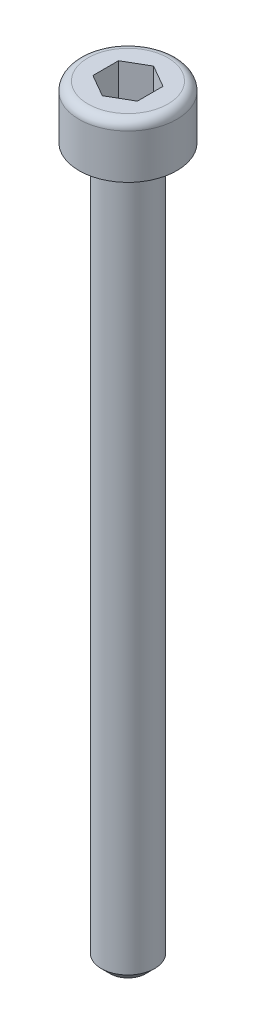
from build123d import *

# Parameters (mm, degrees)
CORTAR_EXTRUIR1_DEPTH = 2
CHAFL_N1_SIZE         = 0.5
REDONDEO1_R           = 0.5


with BuildPart() as part:
    # Croquis1 → Revolución1 (revolve)
    with BuildSketch(Plane.XY, mode=Mode.PRIVATE) as revoluci_n1_sk:
        Polygon((0, 0), (2.75, 0), (2.75, -3), (1.5, -3), (1.5, -43), (0, -43), align=None)
    revolve(revoluci_n1_sk.sketch.rotate(Axis((0, 0, 0), (0, -1, 0)), 90), axis=Axis((0, 0, 0), (0, -1, 0)))

    # Croquis2 → Cortar-Extruir1 (cut)
    with BuildSketch(Plane(origin=(0, 0, 0), x_dir=(1, 0, 0), z_dir=(0, 1, 0))):
        Polygon((1.25, 0.721687836), (0, 1.443375673), (-1.25, 0.721687836), (-1.25, -0.721687836), (0, -1.443375673), (1.25, -0.721687836), align=None)
    extrude(amount=-CORTAR_EXTRUIR1_DEPTH, mode=Mode.SUBTRACT)

    # Chaflán1
    chafl_n1_edges = [part.edges().sort_by_distance(p)[0] for p in [
        (0, -43, -1.5),
    ]]
    chamfer(chafl_n1_edges, length=CHAFL_N1_SIZE)

    # Redondeo1
    redondeo1_edges = [part.edges().sort_by_distance(p)[0] for p in [
        (0, 0, -2.75),
    ]]
    fillet(redondeo1_edges, radius=REDONDEO1_R)


solid = part.part
